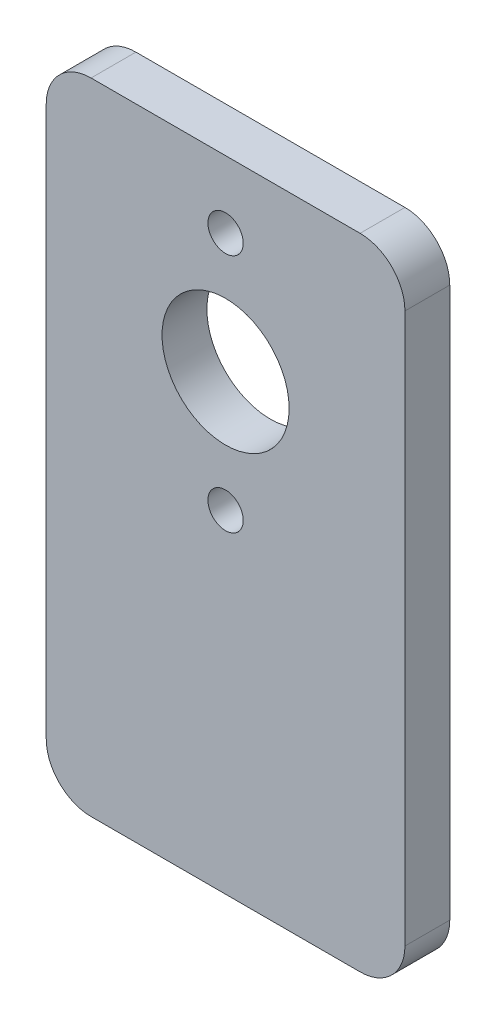
from build123d import *

# Parameters (mm, degrees)
SKETCH1_W             = 25.4
SKETCH1_H             = 45.295
BOSS_EXTRUDE1_DEPTH   = 3.175
SKETCH2_R             = 4.5
CUT_EXTRUDE1_DEPTH    = 27.158743878
M3X0_5_TAPPED_HOLE1_D = 2.5
FILLET1_R             = 3.175


with BuildPart() as part:
    # Sketch1 → Boss-Extrude1 (new body)
    with BuildSketch(Plane.XY):
        Rectangle(SKETCH1_W, SKETCH1_H)
    extrude(amount=BOSS_EXTRUDE1_DEPTH)

    # Sketch2 → Cut-Extrude1 (cut, through all)
    with BuildSketch(Plane.XY.offset(3.175)):
        with Locations((0, 9.3975)):
            Circle(SKETCH2_R)
    extrude(amount=-CUT_EXTRUDE1_DEPTH, mode=Mode.SUBTRACT)

    # M3x0.5 Tapped Hole1 (through all)
    with Locations(Plane.XY.offset(3.175)):
        with Locations((0, 17.8975), (0, 0.8975)):
            Hole(M3X0_5_TAPPED_HOLE1_D / 2)

    # Fillet1
    fillet1_edges = [part.edges().sort_by_distance(p)[0] for p in [
        (12.7, -22.6475, 1.5875),
        (-12.7, -22.6475, 1.5875),
        (-12.7, 22.6475, 1.5875),
        (12.7, 22.6475, 1.5875),
    ]]
    fillet(fillet1_edges, radius=FILLET1_R)


solid = part.part
